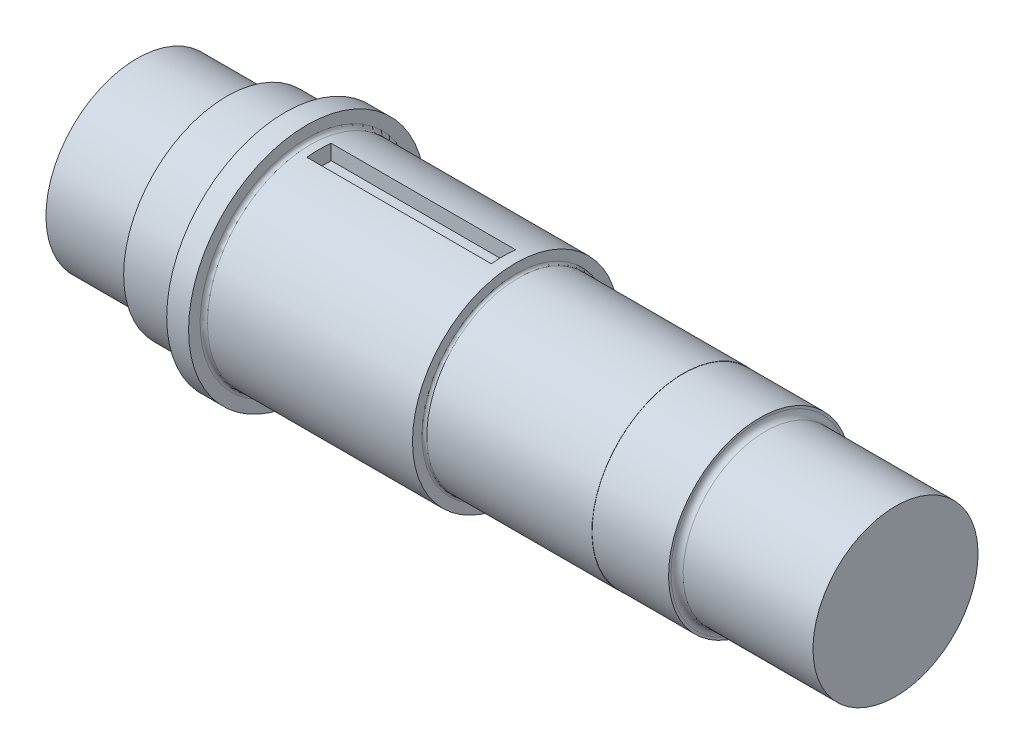
from build123d import *

# Parameters (mm, degrees)
FILLET1_R          = 3
FILLET2_R          = 2
FILLET3_R          = 5
SKETCH2_W          = 152
SKETCH2_H          = 13
CUT_EXTRUDE2_DEPTH = 10


with BuildPart() as part:
    # Sketch1 → Revolve1 (revolve)
    with BuildSketch(Plane.XY, mode=Mode.PRIVATE) as revolve1_sk:
        Polygon((-289.147853111, -40.947499885), (335.852146889, -40.947499885), (335.852146889, 27.052500115), (223.852146889, 27.052500115), (223.852146889, 34.052500115), (160.852146889, 34.052500115), (160.852146889, 34.252500115), (22.852146889, 34.252500115), (22.852146889, 44.052500115), (-149.147853111, 44.052500115), (-149.147853111, 56.552500115), (-167.147853111, 56.552500115), (-167.147853111, 44.052500115), (-215.147853111, 44.052500115), (-215.147853111, 34.052500115), (-289.147853111, 34.052500115), align=None)
    revolve(revolve1_sk.sketch.rotate(Axis((-289.147853111, -40.947499885, 0), (1, 0, 0)), 180), axis=Axis((-289.147853111, -40.947499885, 0), (1, 0, 0)))

    # Fillet1
    fillet1_edges = [part.edges().sort_by_distance(p)[0] for p in [
        (-149.147853111, 44.052500115, 0),
    ]]
    fillet(fillet1_edges, radius=FILLET1_R)

    # Fillet2
    fillet2_edges = [part.edges().sort_by_distance(p)[0] for p in [
        (22.852146889, 34.252500115, 0),
    ]]
    fillet(fillet2_edges, radius=FILLET2_R)

    # Fillet3
    fillet3_edges = [part.edges().sort_by_distance(p)[0] for p in [
        (223.852146889, 27.052500115, 0),
    ]]
    fillet(fillet3_edges, radius=FILLET3_R)

    # Sketch2 → Cut-Extrude2 (cut, symmetric)
    with BuildSketch(Plane.XY):
        with Locations((-63.147853111, 37.552500115)):
            Rectangle(SKETCH2_W, SKETCH2_H)
    extrude(amount=CUT_EXTRUDE2_DEPTH, both=True, mode=Mode.SUBTRACT)


solid = part.part
